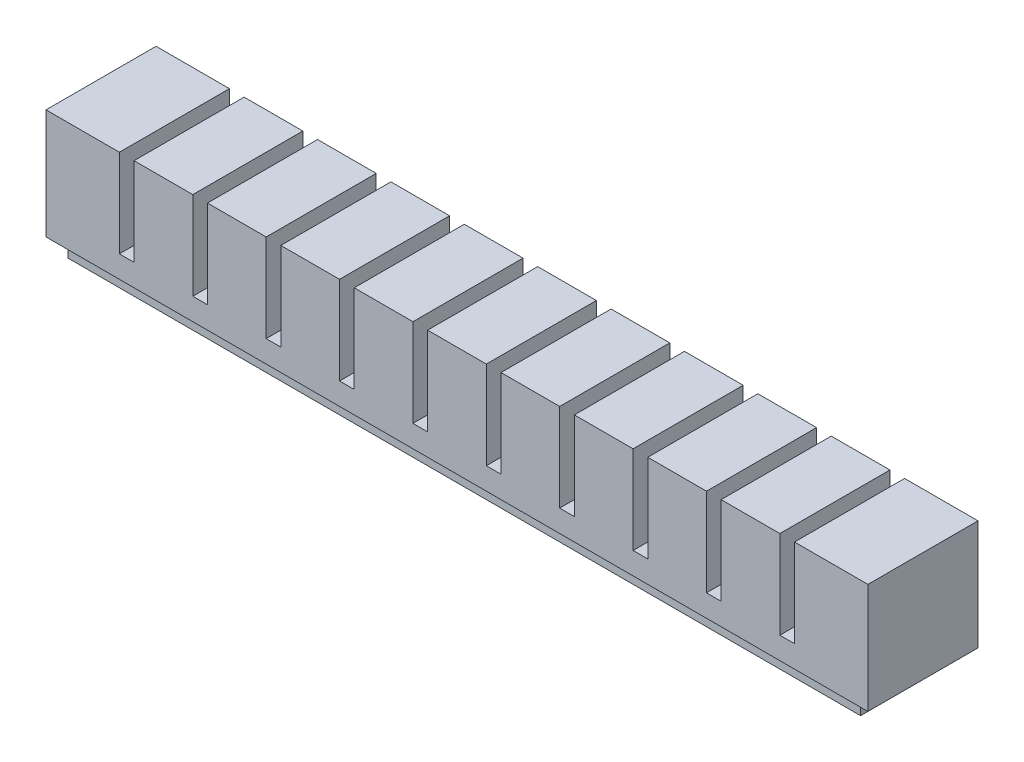
from build123d import *

# Parameters (mm, degrees)
SKETCH1_W                   = 8
SKETCH1_H                   = 15
FIRST_CHAMBER_BLOCK_DEPTH   = 15
SKETCH2_W                   = 6
SKETCH2_H                   = 11
FIRST_CHAMBER_CAVITY_DEPTH  = 13
SKETCH3_W                   = 15
SKETCH3_H                   = 3
CHAMBER_SPACER_DEPTH        = 2
PATTERN_CHAMBERS_COUNT      = 11
PATTERN_CHAMBERS_PITCH      = 10
SKETCH4_W                   = 15
SKETCH4_H                   = 12
THICKEN_END_1_DEPTH         = 2
SKETCH5_W                   = 15
SKETCH5_H                   = 15
THICKEN_END_2_DEPTH         = 2
SKETCH6_W                   = 94
SKETCH6_H                   = 2
CENTRAL_AIR_CHANNEL_DEPTH   = 2
SKETCH7_W                   = 108
SKETCH7_H                   = 13
SKETCH7_W_2                 = 106
SKETCH7_H_2                 = 11
BONDING_RIDGE_DEPTH         = 2
SKETCH9_W                   = 2
SKETCH9_H                   = 2.5
BONDING_BUMPS_DEPTH         = 2
PATTERN_BONDING_BUMPS_COUNT = 10
PATTERN_BONDING_BUMPS_PITCH = 10


with BuildPart() as part:
    # Sketch1 → first chamber block (new body)
    with BuildSketch(Plane.XY):
        with Locations((4, 7.5)):
            Rectangle(SKETCH1_W, SKETCH1_H)
    extrude(amount=FIRST_CHAMBER_BLOCK_DEPTH)

    # Sketch2 → first chamber cavity (cut)
    with BuildSketch(Plane.XZ):
        with Locations((4, 7.5)):
            Rectangle(SKETCH2_W, SKETCH2_H)
    extrude(amount=-FIRST_CHAMBER_CAVITY_DEPTH, mode=Mode.SUBTRACT)

    # Sketch3 → chamber spacer (add)
    with BuildSketch(Plane(origin=(8, 0, 0), x_dir=(0, 0, -1), z_dir=(1, 0, 0))):
        with Locations((-7.5, 1.5)):
            Rectangle(SKETCH3_W, SKETCH3_H)
    extrude(amount=CHAMBER_SPACER_DEPTH)


with BuildPart() as pattern_chambers_1:
    # pattern chambers: pattern copy
    add(part.part.moved(Location(Vector(1, 0, 0) * (1 * PATTERN_CHAMBERS_PITCH))))


with BuildPart() as pattern_chambers_2:
    # pattern chambers: pattern copy
    add(part.part.moved(Location(Vector(1, 0, 0) * (2 * PATTERN_CHAMBERS_PITCH))))


with BuildPart() as pattern_chambers_3:
    # pattern chambers: pattern copy
    add(part.part.moved(Location(Vector(1, 0, 0) * (3 * PATTERN_CHAMBERS_PITCH))))


with BuildPart() as pattern_chambers_4:
    # pattern chambers: pattern copy
    add(part.part.moved(Location(Vector(1, 0, 0) * (4 * PATTERN_CHAMBERS_PITCH))))


with BuildPart() as pattern_chambers_5:
    # pattern chambers: pattern copy
    add(part.part.moved(Location(Vector(1, 0, 0) * (5 * PATTERN_CHAMBERS_PITCH))))


with BuildPart() as pattern_chambers_6:
    # pattern chambers: pattern copy
    add(part.part.moved(Location(Vector(1, 0, 0) * (6 * PATTERN_CHAMBERS_PITCH))))


with BuildPart() as pattern_chambers_7:
    # pattern chambers: pattern copy
    add(part.part.moved(Location(Vector(1, 0, 0) * (7 * PATTERN_CHAMBERS_PITCH))))


with BuildPart() as pattern_chambers_8:
    # pattern chambers: pattern copy
    add(part.part.moved(Location(Vector(1, 0, 0) * (8 * PATTERN_CHAMBERS_PITCH))))


with BuildPart() as pattern_chambers_9:
    # pattern chambers: pattern copy
    add(part.part.moved(Location(Vector(1, 0, 0) * (9 * PATTERN_CHAMBERS_PITCH))))


with BuildPart() as pattern_chambers_10:
    # pattern chambers: pattern copy
    add(part.part.moved(Location(Vector(1, 0, 0) * (10 * PATTERN_CHAMBERS_PITCH))))

    # combine into 1 solid body: union pattern chambers_9, pattern chambers_8, pattern chambers_7, pattern chambers_6, pattern chambers_5, pattern chambers_4, pattern chambers_3, pattern chambers_2, pattern chambers_1, part
    add(pattern_chambers_9.part)
    add(pattern_chambers_8.part)
    add(pattern_chambers_7.part)
    add(pattern_chambers_6.part)
    add(pattern_chambers_5.part)
    add(pattern_chambers_4.part)
    add(pattern_chambers_3.part)
    add(pattern_chambers_2.part)
    add(pattern_chambers_1.part)
    add(part.part)

    # Sketch4 → thicken end 1 (add)
    with BuildSketch(Plane(origin=(108, 0, 0), x_dir=(0, 0, -1), z_dir=(1, 0, 0))):
        with Locations((-7.5, 9)):
            Rectangle(SKETCH4_W, SKETCH4_H)
    extrude(amount=THICKEN_END_1_DEPTH)

    # Sketch5 → thicken end 2 (add)
    with BuildSketch(Plane.ZY):
        with Locations((7.5, 7.5)):
            Rectangle(SKETCH5_W, SKETCH5_H)
    extrude(amount=THICKEN_END_2_DEPTH)

    # Sketch6 → central air channel (cut)
    with BuildSketch(Plane.XZ):
        with Locations((54, 7.5)):
            Rectangle(SKETCH6_W, SKETCH6_H)
    extrude(amount=-CENTRAL_AIR_CHANNEL_DEPTH, mode=Mode.SUBTRACT)

    # Sketch7 → bonding ridge (add)
    with BuildSketch(Plane.XZ):
        with Locations((54, 7.5)):
            Rectangle(SKETCH7_W, SKETCH7_H)
        with Locations((54, 7.5)):
            Rectangle(SKETCH7_W_2, SKETCH7_H_2, mode=Mode.SUBTRACT)
    extrude(amount=BONDING_RIDGE_DEPTH)

    # Sketch9 → bonding bumps (add)
    with BuildSketch(Plane.XZ):
        with Locations((9, 10.75)):
            Rectangle(SKETCH9_W, SKETCH9_H)
        with Locations((9, 4.25)):
            Rectangle(SKETCH9_W, SKETCH9_H)
    bonding_bumps = extrude(amount=BONDING_BUMPS_DEPTH)

    # pattern bonding bumps: bonding bumps ×10
    with Locations(*[(i * PATTERN_BONDING_BUMPS_PITCH, 0, 0) for i in range(1, PATTERN_BONDING_BUMPS_COUNT)]):
        add(bonding_bumps)


solid = pattern_chambers_10.part
